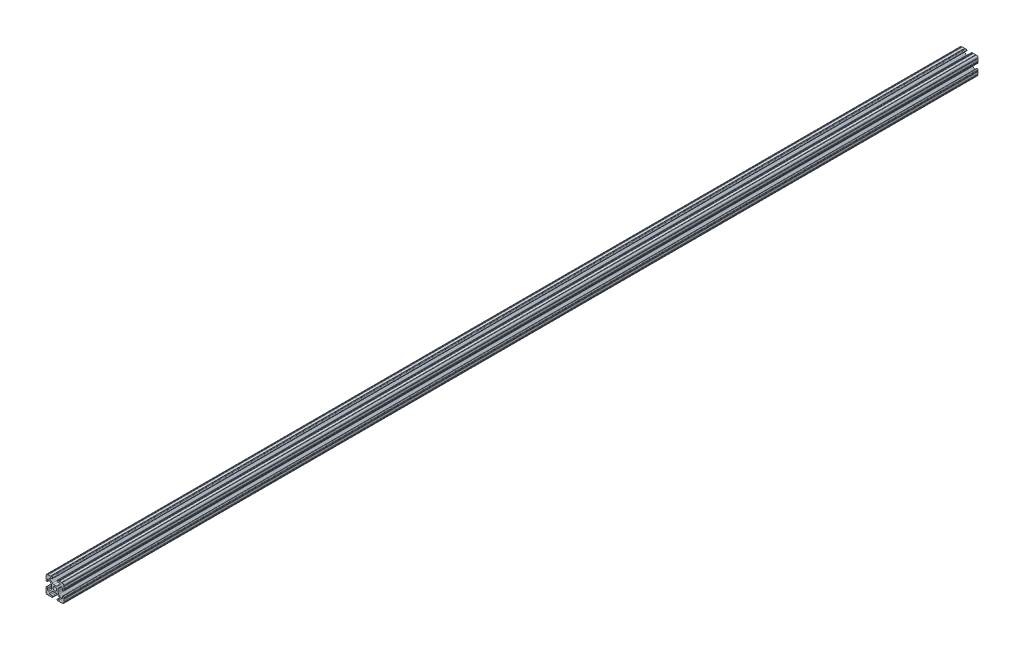
from build123d import *

# Parameters (mm, degrees)
SKETCH1_R           = 2.6035
BOSS_EXTRUDE1_DEPTH = 651.66875


with BuildPart() as part:
    # Sketch1 → Boss-Extrude1 (new, symmetric)
    with BuildSketch(Plane.XY):
        with BuildLine():
            Line((-7.179650497, -8.645192506), (-3.952270251, -5.423690499))
            ThreePointArc((-3.952270251, -5.423690499), (-2.922936451, -4.736929036), (-1.709253557, -4.4958))
            Line((-1.709253557, -4.4958), (1.709253557, -4.4958))
            ThreePointArc((1.709253557, -4.4958), (2.922936451, -4.736929036), (3.952270251, -5.423690499))
            Line((3.952270251, -5.423690499), (7.179650497, -8.645192506))
            ThreePointArc((7.179650497, -8.645192506), (7.41473083, -9.822813117), (6.416408329, -10.4902))
            Line((6.416408329, -10.4902), (4.287512407, -10.4902))
            ThreePointArc((4.287512407, -10.4902), (3.54574862, -10.79744862), (3.2385, -11.539212407))
            Line((3.2385, -11.539212407), (3.2385, -11.650987593))
            ThreePointArc((3.2385, -11.650987593), (3.54574862, -12.39275138), (4.287512407, -12.7))
            Line((4.287512407, -12.7), (5.317126718, -12.7))
            ThreePointArc((5.317126718, -12.7), (5.825126718, -12.192), (6.333126718, -12.7))
            Line((6.333126718, -12.7), (9.550443118, -12.7))
            ThreePointArc((9.550443118, -12.7), (10.058366869, -12.192000006), (10.566443095, -12.699847501))
            ThreePointArc((10.566443095, -12.699847501), (12.082537762, -12.08250727), (12.699846982, -10.566399977))
            ThreePointArc((12.699846982, -10.566399977), (12.192000006, -10.058323491), (12.7, -9.5504))
            Line((12.7, -9.5504), (12.7, -6.3330836))
            ThreePointArc((12.7, -6.3330836), (12.192, -5.8250836), (12.7, -5.3170836))
            Line((12.7, -5.3170836), (12.7, -4.287469289))
            ThreePointArc((12.7, -4.287469289), (12.39275138, -3.545705502), (11.650987593, -3.238456882))
            Line((11.650987593, -3.238456882), (11.539212407, -3.238456882))
            ThreePointArc((11.539212407, -3.238456882), (10.79744862, -3.545705502), (10.4902, -4.287469289))
            Line((10.4902, -4.287469289), (10.4902, -6.402089023))
            ThreePointArc((10.4902, -6.402089023), (9.856505071, -7.351067942), (8.737131347, -7.129408934))
            Line((8.737131347, -7.129408934), (5.441005833, -3.840816462))
            ThreePointArc((5.441005833, -3.840816462), (4.750877967, -2.809883091), (4.5085, -1.593185507))
            Line((4.5085, -1.593185507), (4.5085, 1.593185507))
            ThreePointArc((4.5085, 1.593185507), (4.750877967, 2.809883091), (5.441005833, 3.840816462))
            Line((5.441005833, 3.840816462), (8.737131347, 7.129408934))
            ThreePointArc((8.737131347, 7.129408934), (9.856505071, 7.351067942), (10.4902, 6.402089023))
            Line((10.4902, 6.402089023), (10.4902, 4.287469289))
            ThreePointArc((10.4902, 4.287469289), (10.79744862, 3.545705502), (11.539212407, 3.238456882))
            Line((11.539212407, 3.238456882), (11.650987593, 3.238456882))
            ThreePointArc((11.650987593, 3.238456882), (12.39275138, 3.545705502), (12.7, 4.287469289))
            Line((12.7, 4.287469289), (12.7, 5.3170836))
            ThreePointArc((12.7, 5.3170836), (12.192, 5.8250836), (12.7, 6.3330836))
            Line((12.7, 6.3330836), (12.7, 9.5504))
            ThreePointArc((12.7, 9.5504), (12.192000006, 10.058323491), (12.699846982, 10.566399977))
            ThreePointArc((12.699846982, 10.566399977), (12.082537762, 12.08250727), (10.566443095, 12.699847501))
            ThreePointArc((10.566443095, 12.699847501), (10.058366869, 12.192000006), (9.550443118, 12.7))
            Line((9.550443118, 12.7), (6.333126718, 12.7))
            ThreePointArc((6.333126718, 12.7), (5.825126718, 12.192), (5.317126718, 12.7))
            Line((5.317126718, 12.7), (4.287512407, 12.7))
            ThreePointArc((4.287512407, 12.7), (3.54574862, 12.39275138), (3.2385, 11.650987593))
            Line((3.2385, 11.650987593), (3.2385, 11.539212407))
            ThreePointArc((3.2385, 11.539212407), (3.54574862, 10.79744862), (4.287512407, 10.4902))
            Line((4.287512407, 10.4902), (6.476788598, 10.4902))
            ThreePointArc((6.476788598, 10.4902), (7.432222385, 9.85140422), (7.207036008, 8.724370562))
            Line((7.207036008, 8.724370562), (3.898272566, 5.423169045))
            ThreePointArc((3.898272566, 5.423169045), (2.869120213, 4.736787962), (1.655778399, 4.4958))
            Line((1.655778399, 4.4958), (-1.655778399, 4.4958))
            ThreePointArc((-1.655778399, 4.4958), (-2.869120213, 4.736787962), (-3.898272566, 5.423169045))
            Line((-3.898272566, 5.423169045), (-7.207036008, 8.724370562))
            ThreePointArc((-7.207036008, 8.724370562), (-7.432222385, 9.85140422), (-6.476788598, 10.4902))
            Line((-6.476788598, 10.4902), (-4.287512407, 10.4902))
            ThreePointArc((-4.287512407, 10.4902), (-3.54574862, 10.79744862), (-3.2385, 11.539212407))
            Line((-3.2385, 11.539212407), (-3.2385, 11.650987593))
            ThreePointArc((-3.2385, 11.650987593), (-3.54574862, 12.39275138), (-4.287512407, 12.7))
            Line((-4.287512407, 12.7), (-5.317126718, 12.7))
            ThreePointArc((-5.317126718, 12.7), (-5.825126718, 12.192), (-6.333126718, 12.7))
            Line((-6.333126718, 12.7), (-9.550443118, 12.7))
            ThreePointArc((-9.550443118, 12.7), (-10.058366869, 12.192000006), (-10.566443095, 12.699847501))
            ThreePointArc((-10.566443095, 12.699847501), (-12.082537762, 12.08250727), (-12.699846982, 10.566399977))
            ThreePointArc((-12.699846982, 10.566399977), (-12.192000006, 10.058323491), (-12.7, 9.5504))
            Line((-12.7, 9.5504), (-12.7, 6.3330836))
            ThreePointArc((-12.7, 6.3330836), (-12.192, 5.8250836), (-12.7, 5.3170836))
            Line((-12.7, 5.3170836), (-12.7, 4.287469289))
            ThreePointArc((-12.7, 4.287469289), (-12.39275138, 3.545705502), (-11.650987593, 3.238456882))
            Line((-11.650987593, 3.238456882), (-11.539212407, 3.238456882))
            ThreePointArc((-11.539212407, 3.238456882), (-10.79744862, 3.545705502), (-10.4902, 4.287469289))
            Line((-10.4902, 4.287469289), (-10.4902, 6.402089023))
            ThreePointArc((-10.4902, 6.402089023), (-9.856505071, 7.351067942), (-8.737131347, 7.129408934))
            Line((-8.737131347, 7.129408934), (-5.441005833, 3.840816462))
            ThreePointArc((-5.441005833, 3.840816462), (-4.750877967, 2.809883091), (-4.5085, 1.593185507))
            Line((-4.5085, 1.593185507), (-4.5085, -1.593185507))
            ThreePointArc((-4.5085, -1.593185507), (-4.750877967, -2.809883091), (-5.441005833, -3.840816462))
            Line((-5.441005833, -3.840816462), (-8.737131347, -7.129408934))
            ThreePointArc((-8.737131347, -7.129408934), (-9.856505071, -7.351067942), (-10.4902, -6.402089023))
            Line((-10.4902, -6.402089023), (-10.4902, -4.287469289))
            ThreePointArc((-10.4902, -4.287469289), (-10.79744862, -3.545705502), (-11.539212407, -3.238456882))
            Line((-11.539212407, -3.238456882), (-11.650987593, -3.238456882))
            ThreePointArc((-11.650987593, -3.238456882), (-12.39275138, -3.545705502), (-12.7, -4.287469289))
            Line((-12.7, -4.287469289), (-12.7, -5.3170836))
            ThreePointArc((-12.7, -5.3170836), (-12.192, -5.8250836), (-12.7, -6.3330836))
            Line((-12.7, -6.3330836), (-12.7, -9.5504))
            ThreePointArc((-12.7, -9.5504), (-12.192000006, -10.058323491), (-12.699846982, -10.566399977))
            ThreePointArc((-12.699846982, -10.566399977), (-12.082537762, -12.08250727), (-10.566443095, -12.699847501))
            ThreePointArc((-10.566443095, -12.699847501), (-10.058366869, -12.192000006), (-9.550443118, -12.7))
            Line((-9.550443118, -12.7), (-6.333126718, -12.7))
            ThreePointArc((-6.333126718, -12.7), (-5.825126718, -12.192), (-5.317126718, -12.7))
            Line((-5.317126718, -12.7), (-4.287512407, -12.7))
            ThreePointArc((-4.287512407, -12.7), (-3.54574862, -12.39275138), (-3.2385, -11.650987593))
            Line((-3.2385, -11.650987593), (-3.2385, -11.539212407))
            ThreePointArc((-3.2385, -11.539212407), (-3.54574862, -10.79744862), (-4.287512407, -10.4902))
            Line((-4.287512407, -10.4902), (-6.416408329, -10.4902))
            ThreePointArc((-6.416408329, -10.4902), (-7.41473083, -9.822813117), (-7.179650497, -8.645192506))
        make_face()
        Circle(SKETCH1_R, mode=Mode.SUBTRACT)
    extrude(amount=BOSS_EXTRUDE1_DEPTH, both=True)


solid = part.part
